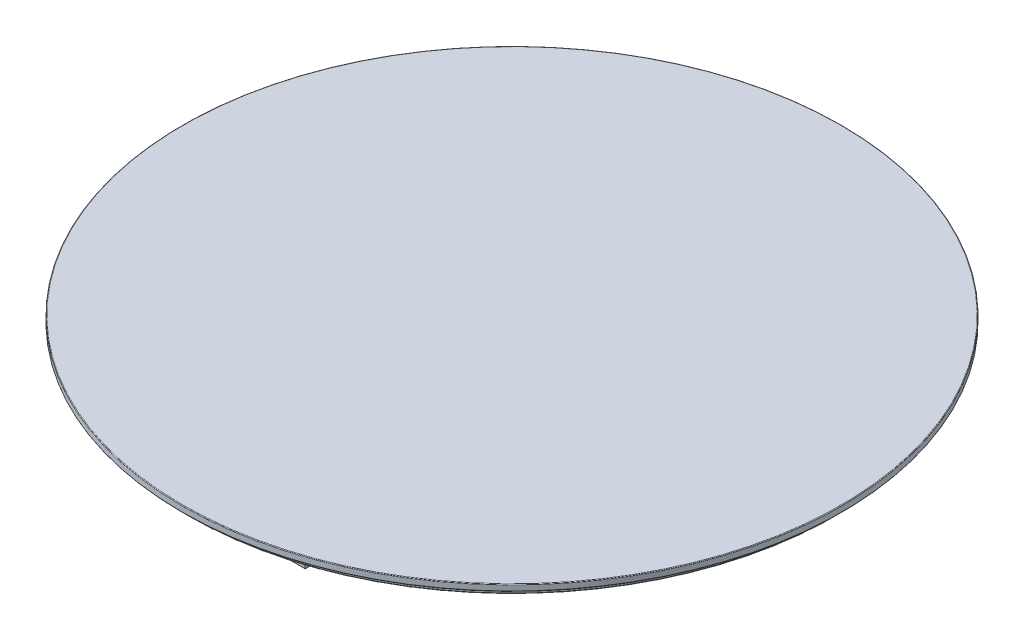
from build123d import *

# Parameters (mm, degrees)
SKETCH1_R           = 255
BOSS_EXTRUDE1_DEPTH = 10
SKETCH4_R           = 255
SKETCH4_R_2         = 250
CUT_EXTRUDE1_DEPTH  = 5
FILLET1_R           = 0.5
SKETCH5_W           = 120
SKETCH5_H           = 170
BOSS_EXTRUDE3_DEPTH = 20
CIRPATTERN2_COUNT   = 3
SKETCH6_W           = 110
SKETCH6_H           = 160
CUT_EXTRUDE3_DEPTH  = 20
CIRPATTERN4_COUNT   = 3


with BuildPart() as part:
    # Sketch1 → Boss-Extrude1 (new body)
    with BuildSketch(Plane(origin=(0, 0, 0), x_dir=(1, 0, 0), z_dir=(0, 1, 0))):
        with Locations(Location((0, 0, 0), (0, 0, 270))):
            Circle(SKETCH1_R)
    extrude(amount=BOSS_EXTRUDE1_DEPTH)

    # Sketch4 → Cut-Extrude1 (cut)
    with BuildSketch(Plane(origin=(0, 0, 0), x_dir=(-1, 0, 0), z_dir=(0, -1, 0))):
        with Locations(Location((0, 0, 0), (0, 0, 90))):
            Circle(SKETCH4_R)
        with Locations(Location((0, 0, 0), (0, 0, 90))):
            Circle(SKETCH4_R_2, mode=Mode.SUBTRACT)
    extrude(amount=-CUT_EXTRUDE1_DEPTH, mode=Mode.SUBTRACT)

    # Fillet1
    fillet1_edges = [part.edges().sort_by_distance(p)[0] for p in [
        (0, 10, -255),
        (0, 0, 250),
        (0, 5, -255),
    ]]
    fillet(fillet1_edges, radius=FILLET1_R)

    # Sketch5 → Boss-Extrude3 (add)
    with BuildSketch(Plane.XZ):
        with Locations((0, 135)):
            Rectangle(SKETCH5_W, SKETCH5_H)
    boss_extrude3 = extrude(amount=BOSS_EXTRUDE3_DEPTH)

    # CirPattern2: Boss-Extrude3 ×3 about axis
    cirpattern2_axis = Axis((0, 0, 0), (0, 1, 0))
    for i in range(1, CIRPATTERN2_COUNT):
        add(boss_extrude3.rotate(cirpattern2_axis, i * 360 / CIRPATTERN2_COUNT))

    # Sketch6 → Cut-Extrude3 (cut)
    with BuildSketch(Plane.XZ.offset(20)):
        with Locations((0, 135)):
            Rectangle(SKETCH6_W, SKETCH6_H)
    cut_extrude3 = extrude(amount=-CUT_EXTRUDE3_DEPTH, mode=Mode.SUBTRACT)

    # CirPattern4: Cut-Extrude3 ×3 about axis
    cirpattern4_axis = Axis((0, 0, 0), (0, 1, 0))
    for i in range(1, CIRPATTERN4_COUNT):
        add(cut_extrude3.rotate(cirpattern4_axis, i * 360 / CIRPATTERN4_COUNT), mode=Mode.SUBTRACT)


solid = part.part
